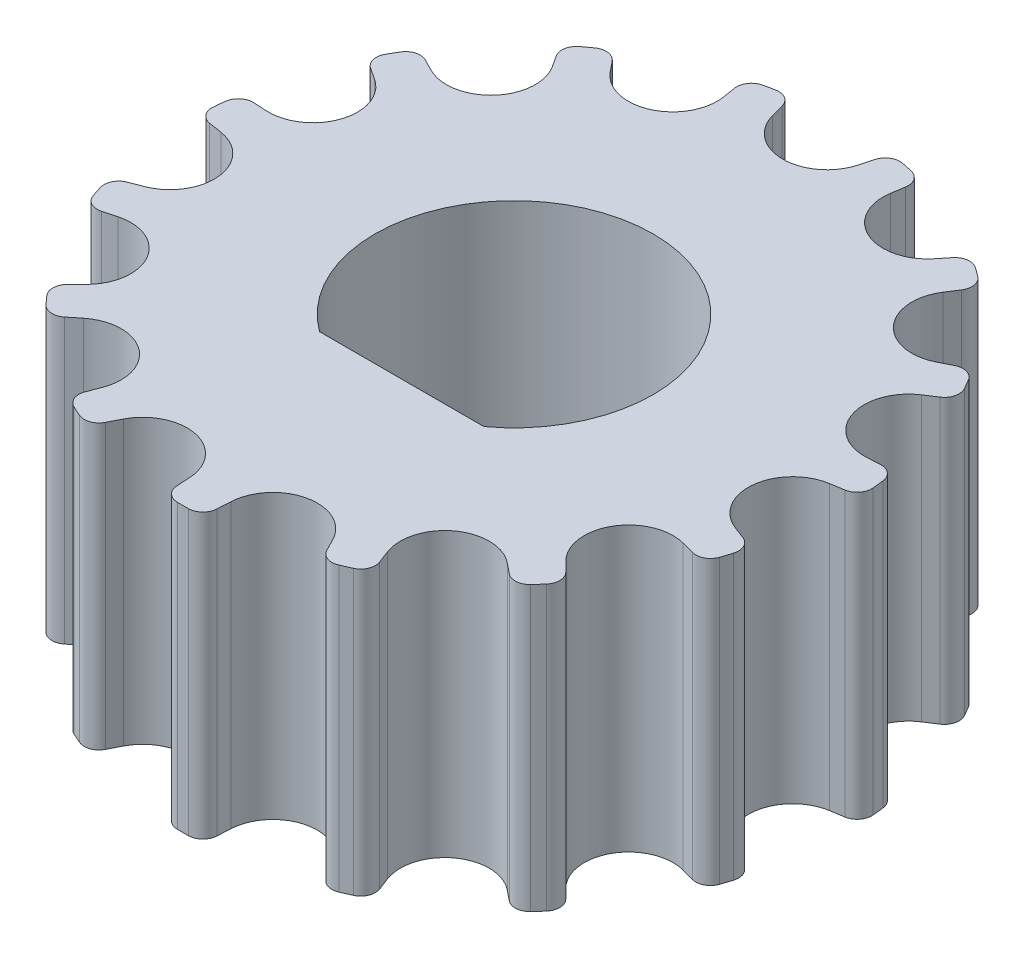
from build123d import *

# Parameters (mm, degrees)
SKETCH1_R           = 7.161972439
BOSS_EXTRUDE1_DEPTH = 5.8
CUT_EXTRUDE1_DEPTH  = 12.671662197
CIRPATTERN1_COUNT   = 15
CUT_EXTRUDE2_DEPTH  = 12.192213007


with BuildPart() as part:
    # Sketch1 → Boss-Extrude1 (new body)
    with BuildSketch(Plane(origin=(0, 0, 0), x_dir=(1, 0, 0), z_dir=(0, 1, 0))):
        with Locations(Location((0, 0, 0), (0, 0, 270))):
            Circle(SKETCH1_R)
    extrude(amount=BOSS_EXTRUDE1_DEPTH)

    # Sketch2 → Cut-Extrude1 (cut, through all)
    with BuildSketch(Plane(origin=(0, 5.8, 0), x_dir=(1, 0, 0), z_dir=(0, 1, 0))):
        with BuildLine():
            Line((-0.878729311, 6.174467051), (-0.95, 6.439271351))
            ThreePointArc((-0.95, 6.439271351), (-1.080918358, 6.615843804), (-1.297075471, 6.6557631))
            ThreePointArc((-1.297075471, 6.6557631), (-2.040634656, 6.466637257), (-2.758069967, 6.19472657))
            Line((-2.758069967, 6.19472657), (-2.758069967, 7.161972439))
            Line((-2.758069967, 7.161972439), (2.758069967, 7.161972439))
            Line((2.758069967, 7.161972439), (2.758069967, 6.19472657))
            ThreePointArc((2.758069967, 6.19472657), (2.040634656, 6.466637257), (1.297075471, 6.6557631))
            ThreePointArc((1.297075471, 6.6557631), (1.080918358, 6.615843804), (0.95, 6.439271351))
            Line((0.95, 6.439271351), (0.878729311, 6.174467051))
            ThreePointArc((0.878729311, 6.174467051), (0, 5.500972439), (-0.878729311, 6.174467051))
        make_face()
    cut_extrude1 = extrude(amount=-CUT_EXTRUDE1_DEPTH, mode=Mode.SUBTRACT)

    # CirPattern1: Cut-Extrude1 ×15 about axis
    cirpattern1_axis = Axis((0, 0, 0), (0, 1, 0))
    for i in range(1, CIRPATTERN1_COUNT):
        add(cut_extrude1.rotate(cirpattern1_axis, i * 360 / CIRPATTERN1_COUNT), mode=Mode.SUBTRACT)

    # Sketch3 → Cut-Extrude2 (cut, through all)
    with BuildSketch(Plane.XZ):
        with BuildLine():
            Line((1.683003268, 2.3), (-1.683003268, 2.3))
            ThreePointArc((-1.683003268, 2.3), (0, -2.85), (1.683003268, 2.3))
        make_face()
    extrude(amount=-CUT_EXTRUDE2_DEPTH, mode=Mode.SUBTRACT)


solid = part.part
